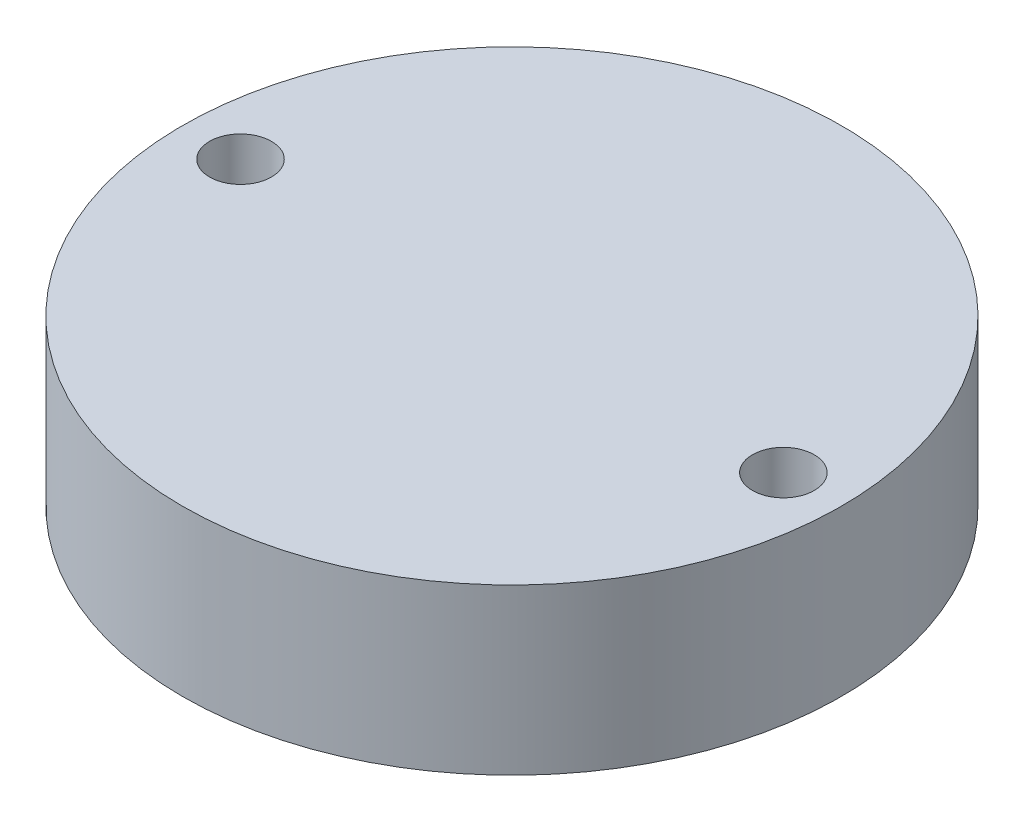
from build123d import *

# Parameters (mm, degrees)
SKETCH1_R           = 12.7
BOSS_EXTRUDE1_DEPTH = 6.35
CUT_EXTRUDE1_DEPTH  = 3.175
SKETCH1_5_R         = 1.193106662
CUT_EXTRUDE2_DEPTH  = 20.05


with BuildPart() as part:
    # Sketch1 → Boss-Extrude1 (new body)
    with BuildSketch(Plane(origin=(0, 0, 0), x_dir=(1, 0, 0), z_dir=(0, 1, 0))):
        Circle(SKETCH1_R)
    extrude(amount=BOSS_EXTRUDE1_DEPTH)

    # Sketch1<3> → Cut-Extrude1 (cut)
    with BuildSketch(Plane(origin=(0, 0, 0), x_dir=(1, 0, 0), z_dir=(0, 1, 0))):
        with BuildLine():
            ThreePointArc((-9.498704201, 0.707278937), (-9.26646174, 0), (-9.498704201, -0.707278937))
            ThreePointArc((-9.498704201, -0.707278937), (0, -9.525), (9.498704201, -0.707278937))
            ThreePointArc((9.498704201, -0.707278937), (9.26646174, 0), (9.498704201, 0.707278937))
            ThreePointArc((9.498704201, 0.707278937), (0, 9.525), (-9.498704201, 0.707278937))
        make_face()
    extrude(amount=CUT_EXTRUDE1_DEPTH, mode=Mode.SUBTRACT)

    # Sketch1<5> → Cut-Extrude2 (cut, through all)
    with BuildSketch(Plane(origin=(0, 0, 0), x_dir=(1, 0, 0), z_dir=(0, 1, 0))):
        with Locations((-10.459568402, 0)):
            Circle(SKETCH1_5_R)
        with Locations((10.459568402, 0)):
            Circle(SKETCH1_5_R)
    extrude(amount=CUT_EXTRUDE2_DEPTH, mode=Mode.SUBTRACT)


solid = part.part
